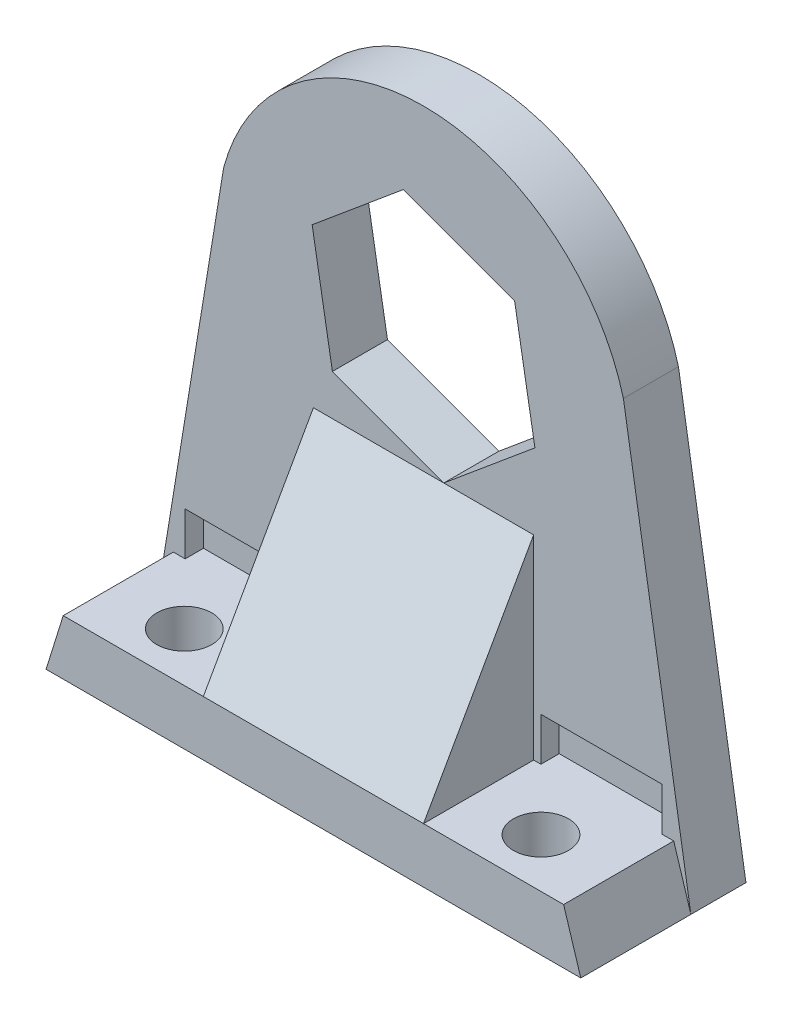
from build123d import *

# Parameters (mm, degrees)
SKETCH_1_R          = 6.5
EXTRUDE_1_DEPTH     = 3
EXTRUDE_2_DEPTH     = 6
SKETCH_5_R          = 1.5
CUT_EXTRUDE_1_DEPTH = 6
EXTRUDE_3_DEPTH     = 3
SKETCH_7_R          = 7.581975651
EXTRUDE_4_DEPTH     = 3
CUT_EXTRUDE_2_DEPTH = 3
EXTRUDE_5_DEPTH     = 6
SKETCH_10_W         = 6.596302857
SKETCH_10_H         = 2.358868677
CUT_EXTRUDE_3_DEPTH = 1


with BuildPart() as part:
    # 草图1 → 凸台-拉伸1 (new body)
    with BuildSketch(Plane.XY):
        with BuildLine():
            Line((0, -11.15), (-14.569688113, -11.15))
            Line((-14.569688113, -11.15), (-10.110162273, 3.152379613))
            ThreePointArc((-10.110162273, 3.152379613), (0, 10.590225607), (10.110162273, 3.152379613))
            Line((10.110162273, 3.152379613), (14.569688113, -11.15))
            Line((14.569688113, -11.15), (0, -11.15))
        make_face()
        Circle(SKETCH_1_R, mode=Mode.SUBTRACT)
    extrude(amount=EXTRUDE_1_DEPTH)

    # 草图4 → 凸台-拉伸2 (add)
    with BuildSketch(Plane.XY.offset(3)):
        Polygon((0, -8.15), (13.63427891, -8.15), (14.569688113, -11.15), (-14.569688113, -11.15), (-13.63427891, -8.15), align=None)
    extrude(amount=EXTRUDE_2_DEPTH)

    # 草图5 → 切除-拉伸1 (cut)
    with BuildSketch(Plane(origin=(0, -8.15, 0), x_dir=(1, 0, 0), z_dir=(0, 1, 0))):
        with Locations(Location((-9.718639025, -6.319329225, 0), (0, 0, 270))):
            Circle(SKETCH_5_R)
        with Locations(Location((9.718639025, -6.319329225, 0), (0, 0, 180))):
            Circle(SKETCH_5_R)
    extrude(amount=-CUT_EXTRUDE_1_DEPTH, mode=Mode.SUBTRACT)

    # 草图6 → 凸台-拉伸3 (add)
    with BuildSketch(Plane(origin=(0, 0, 0), x_dir=(-1, 0, 0), z_dir=(0, 0, -1))):
        with BuildLine():
            Line((10.110162273, 3.152379613), (14.569688113, -11.15))
            Line((14.569688113, -11.15), (11.256321717, 9.136259589))
            Line((11.256321717, 9.136259589), (10.892618435, 11.363052016))
            ThreePointArc((10.892618435, 11.363052016), (0, 19.718638154), (-10.892618435, 11.363052016))
            Line((-10.892618435, 11.363052016), (-11.256321717, 9.136259589))
            Line((-11.256321717, 9.136259589), (-14.569688113, -11.15))
            Line((-14.569688113, -11.15), (-10.110162273, 3.152379613))
            ThreePointArc((-10.110162273, 3.152379613), (0, 10.590225607), (10.110162273, 3.152379613))
        make_face()
    extrude(amount=-EXTRUDE_3_DEPTH)

    # 草图7 → 凸台-拉伸4 (add)
    with BuildSketch(Plane(origin=(0, 0, 0), x_dir=(-1, 0, 0), z_dir=(0, 0, -1))):
        Circle(SKETCH_7_R)
    extrude(amount=-EXTRUDE_4_DEPTH)

    # 草图8 → 切除-拉伸2 (cut)
    with BuildSketch(Plane(origin=(0, 0, 0), x_dir=(-1, 0, 0), z_dir=(0, 0, -1))):
        Polygon((1.103523442, 15.221465243), (-4.966089039, 12.991411956), (-6.069612481, 6.619946712), (-1.103523442, 2.478534757), (4.966089039, 4.708588044), (6.069612481, 11.080053288), align=None)
    extrude(amount=-CUT_EXTRUDE_2_DEPTH, mode=Mode.SUBTRACT)

    # 草图9 → 凸台-拉伸5 (add, symmetric)
    with BuildSketch(Plane(origin=(0, 0, 0), x_dir=(0, 0, -1), z_dir=(1, 0, 0))):
        Polygon((-9, -8.15), (-3, 2.478534757), (-3, -8.15), align=None)
    extrude(amount=EXTRUDE_5_DEPTH, both=True)

    # 草图10 → 切除-拉伸3 (cut)
    with BuildSketch(Plane.XY.offset(3)):
        with Locations((-9.693347491, -6.970565662)):
            Rectangle(SKETCH_10_W, SKETCH_10_H)
        with Locations((9.693347491, -6.970565662)):
            Rectangle(SKETCH_10_W, SKETCH_10_H)
    extrude(amount=-CUT_EXTRUDE_3_DEPTH, mode=Mode.SUBTRACT)


solid = part.part
